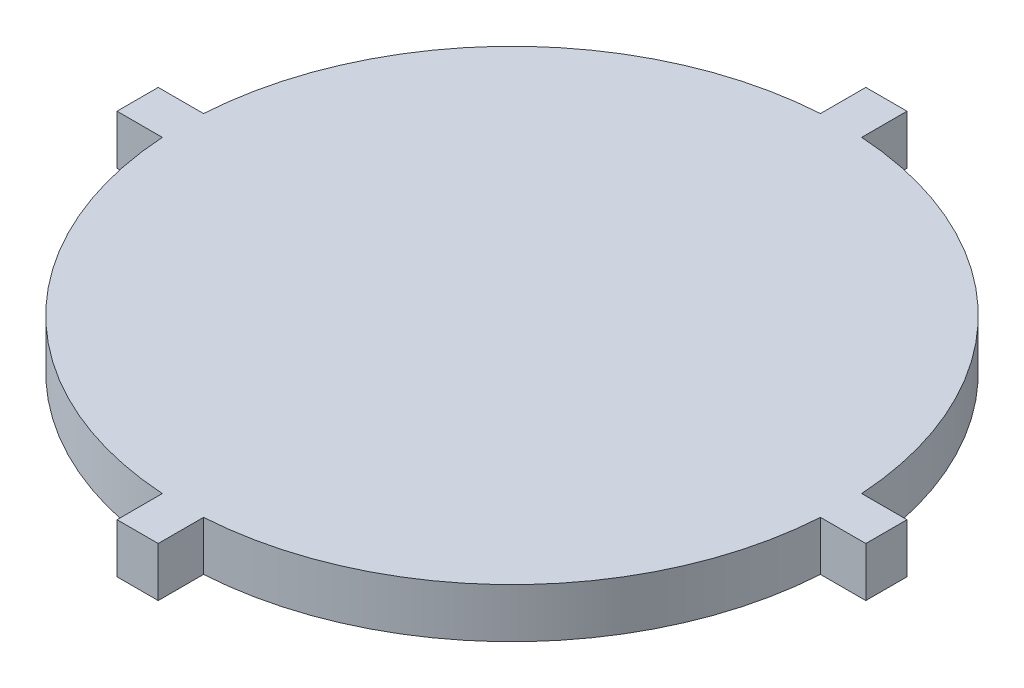
from build123d import *

# Parameters (mm, degrees)
BOSS_EXTRUDE2_DEPTH = 15.24


with BuildPart() as part:
    # Sketch1 → Boss-Extrude2 (new body)
    with BuildSketch(Plane(origin=(0, 0, 0), x_dir=(1, 0, 0), z_dir=(0, 1, 0))):
        with BuildLine():
            Line((-6.35, 115.371368334), (6.35, 115.371368334))
            Line((6.35, 115.371368334), (6.35, 101.401368334))
            ThreePointArc((6.35, 101.401368334), (71.842048969, 71.842048969), (101.401368334, 6.35))
            Line((101.401368334, 6.35), (115.371368334, 6.35))
            Line((115.371368334, 6.35), (115.371368334, -3.175))
            Line((115.371368334, -3.175), (115.371368334, -6.35))
            Line((115.371368334, -6.35), (101.401368334, -6.35))
            ThreePointArc((101.401368334, -6.35), (71.842048969, -71.842048969), (6.35, -101.401368334))
            Line((6.35, -101.401368334), (6.35, -115.371368334))
            Line((6.35, -115.371368334), (-6.35, -115.371368334))
            Line((-6.35, -115.371368334), (-6.35, -101.401368334))
            ThreePointArc((-6.35, -101.401368334), (-71.842048969, -71.842048969), (-101.401368334, -6.35))
            Line((-101.401368334, -6.35), (-115.371368334, -6.35))
            Line((-115.371368334, -6.35), (-115.371368334, 6.35))
            Line((-115.371368334, 6.35), (-101.401368334, 6.35))
            ThreePointArc((-101.401368334, 6.35), (-71.842048969, 71.842048969), (-6.35, 101.401368334))
            Line((-6.35, 101.401368334), (-6.35, 115.371368334))
        make_face()
    extrude(amount=BOSS_EXTRUDE2_DEPTH)


solid = part.part
